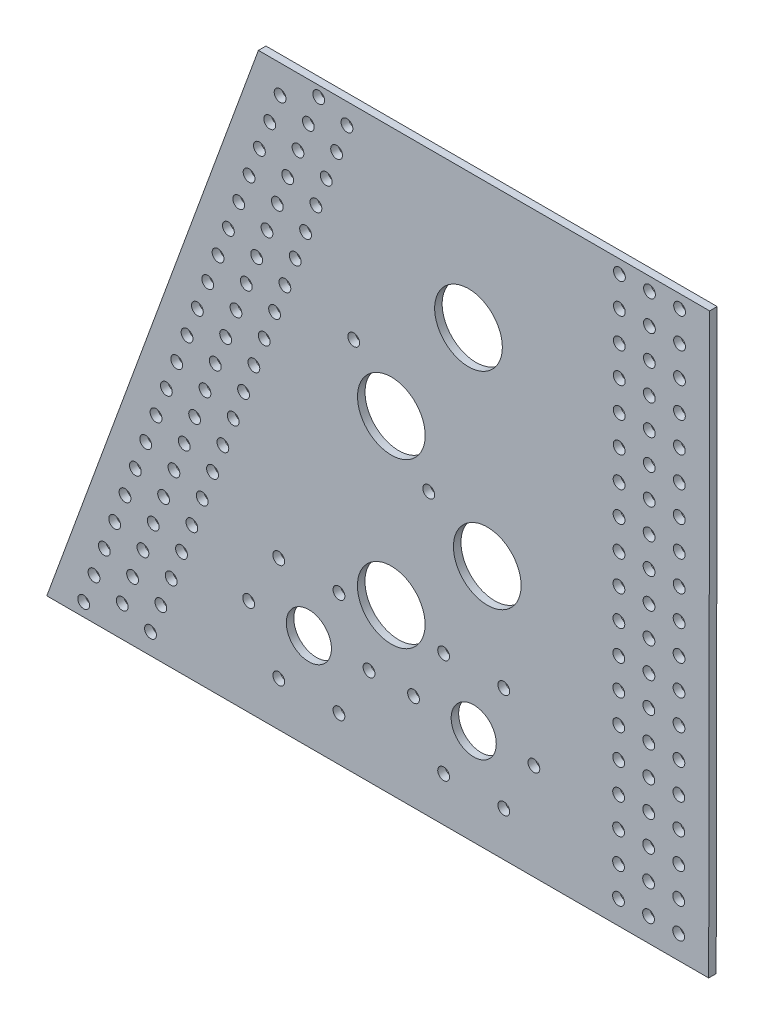
from build123d import *

# Parameters (mm, degrees)
SKETCH4_R           = 14.2875
SKETCH4_R_2         = 2.4892
SKETCH4_R_3         = 9.525
BOSS_EXTRUDE2_DEPTH = 3.175
SKETCH11_R          = 2.4892
CUT_EXTRUDE2_DEPTH  = 3.175


with BuildPart() as part:
    # Sketch4 → Boss-Extrude2 (new body)
    with BuildSketch(Plane.XY):
        Polygon((93.776397203, 244.095891287), (284.276397203, 244.095891287), (283.85323076, 0), (4.45323076, 0), align=None)
        with Locations((182.46816735, 187.031911832)):
            Circle(SKETCH4_R, mode=Mode.SUBTRACT)
        with Locations((149.900784931, 138.468767486)):
            Circle(SKETCH4_R, mode=Mode.SUBTRACT)
        with Locations((134.00552713, 158.435496689)):
            Circle(SKETCH4_R_2, mode=Mode.SUBTRACT)
        with Locations((165.694943773, 118.731329743)):
            Circle(SKETCH4_R_2, mode=Mode.SUBTRACT)
        with Locations((190.39276448, 103.84941923)):
            Circle(SKETCH4_R, mode=Mode.SUBTRACT)
        with Locations((149.858385304, 69.329241783)):
            Circle(SKETCH4_R, mode=Mode.SUBTRACT)
        with Locations((197.368237983, 18.743845986)):
            Circle(SKETCH4_R_2, mode=Mode.SUBTRACT)
        with Locations((115.072237983, 40.740891242)):
            Circle(SKETCH4_R_3, mode=Mode.SUBTRACT)
        with Locations((184.668237983, 40.740891242)):
            Circle(SKETCH4_R_3, mode=Mode.SUBTRACT)
        with Locations((210.068237983, 40.740891242)):
            Circle(SKETCH4_R_2, mode=Mode.SUBTRACT)
        with Locations((171.968237983, 18.743845986)):
            Circle(SKETCH4_R_2, mode=Mode.SUBTRACT)
        with Locations((159.268237983, 40.740891242)):
            Circle(SKETCH4_R_2, mode=Mode.SUBTRACT)
        with Locations((171.968237983, 62.737936498)):
            Circle(SKETCH4_R_2, mode=Mode.SUBTRACT)
        with Locations((197.368237983, 62.737936498)):
            Circle(SKETCH4_R_2, mode=Mode.SUBTRACT)
        with Locations((140.472237983, 40.740891242)):
            Circle(SKETCH4_R_2, mode=Mode.SUBTRACT)
        with Locations((127.772237983, 18.743845986)):
            Circle(SKETCH4_R_2, mode=Mode.SUBTRACT)
        with Locations((102.372237983, 18.743845986)):
            Circle(SKETCH4_R_2, mode=Mode.SUBTRACT)
        with Locations((89.672237983, 40.740891242)):
            Circle(SKETCH4_R_2, mode=Mode.SUBTRACT)
        with Locations((102.372237983, 62.737936498)):
            Circle(SKETCH4_R_2, mode=Mode.SUBTRACT)
        with Locations((127.772237983, 62.737936498)):
            Circle(SKETCH4_R_2, mode=Mode.SUBTRACT)
    extrude(amount=BOSS_EXTRUDE2_DEPTH)

    # Sketch11 → Cut-Extrude2 (cut)
    with BuildSketch(Plane.XY.offset(3.175)):
        with Locations((271.566690721, 238.507891287)):
            Circle(SKETCH11_R)
        with Locations((258.866690721, 238.507891287)):
            Circle(SKETCH11_R)
        with Locations((246.166690721, 238.507891287)):
            Circle(SKETCH11_R)
        with Locations((258.84467394, 225.807910372)):
            Circle(SKETCH11_R)
        with Locations((246.14467394, 225.807910372)):
            Circle(SKETCH11_R)
        with Locations((258.822657159, 213.107929456)):
            Circle(SKETCH11_R)
        with Locations((246.122657159, 213.107929456)):
            Circle(SKETCH11_R)
        with Locations((258.800640378, 200.40794854)):
            Circle(SKETCH11_R)
        with Locations((246.100640378, 200.40794854)):
            Circle(SKETCH11_R)
        with Locations((258.778623597, 187.707967624)):
            Circle(SKETCH11_R)
        with Locations((246.078623597, 187.707967624)):
            Circle(SKETCH11_R)
        with Locations((258.756606817, 175.007986708)):
            Circle(SKETCH11_R)
        with Locations((246.056606817, 175.007986708)):
            Circle(SKETCH11_R)
        with Locations((258.734590036, 162.308005793)):
            Circle(SKETCH11_R)
        with Locations((246.034590036, 162.308005793)):
            Circle(SKETCH11_R)
        with Locations((258.712573255, 149.608024877)):
            Circle(SKETCH11_R)
        with Locations((246.012573255, 149.608024877)):
            Circle(SKETCH11_R)
        with Locations((258.690556474, 136.908043961)):
            Circle(SKETCH11_R)
        with Locations((245.990556474, 136.908043961)):
            Circle(SKETCH11_R)
        with Locations((258.668539693, 124.208063045)):
            Circle(SKETCH11_R)
        with Locations((245.968539693, 124.208063045)):
            Circle(SKETCH11_R)
        with Locations((258.646522912, 111.508082129)):
            Circle(SKETCH11_R)
        with Locations((245.946522912, 111.508082129)):
            Circle(SKETCH11_R)
        with Locations((258.624506131, 98.808101214)):
            Circle(SKETCH11_R)
        with Locations((245.924506131, 98.808101214)):
            Circle(SKETCH11_R)
        with Locations((258.60248935, 86.108120298)):
            Circle(SKETCH11_R)
        with Locations((245.90248935, 86.108120298)):
            Circle(SKETCH11_R)
        with Locations((258.58047257, 73.408139382)):
            Circle(SKETCH11_R)
        with Locations((245.88047257, 73.408139382)):
            Circle(SKETCH11_R)
        with Locations((258.558455789, 60.708158466)):
            Circle(SKETCH11_R)
        with Locations((245.858455789, 60.708158466)):
            Circle(SKETCH11_R)
        with Locations((258.536439008, 48.008177551)):
            Circle(SKETCH11_R)
        with Locations((245.836439008, 48.008177551)):
            Circle(SKETCH11_R)
        with Locations((258.514422227, 35.308196635)):
            Circle(SKETCH11_R)
        with Locations((245.814422227, 35.308196635)):
            Circle(SKETCH11_R)
        with Locations((258.492405446, 22.608215719)):
            Circle(SKETCH11_R)
        with Locations((245.792405446, 22.608215719)):
            Circle(SKETCH11_R)
        with Locations((258.470388665, 9.908234803)):
            Circle(SKETCH11_R)
        with Locations((245.770388665, 9.908234803)):
            Circle(SKETCH11_R)
        with Locations((271.54467394, 225.807910372)):
            Circle(SKETCH11_R)
        with Locations((271.522657159, 213.107929456)):
            Circle(SKETCH11_R)
        with Locations((271.500640378, 200.40794854)):
            Circle(SKETCH11_R)
        with Locations((271.478623597, 187.707967624)):
            Circle(SKETCH11_R)
        with Locations((271.456606817, 175.007986708)):
            Circle(SKETCH11_R)
        with Locations((271.434590036, 162.308005793)):
            Circle(SKETCH11_R)
        with Locations((271.412573255, 149.608024877)):
            Circle(SKETCH11_R)
        with Locations((271.390556474, 136.908043961)):
            Circle(SKETCH11_R)
        with Locations((271.368539693, 124.208063045)):
            Circle(SKETCH11_R)
        with Locations((271.346522912, 111.508082129)):
            Circle(SKETCH11_R)
        with Locations((271.324506131, 98.808101214)):
            Circle(SKETCH11_R)
        with Locations((271.30248935, 86.108120298)):
            Circle(SKETCH11_R)
        with Locations((271.28047257, 73.408139382)):
            Circle(SKETCH11_R)
        with Locations((271.258455789, 60.708158466)):
            Circle(SKETCH11_R)
        with Locations((271.236439008, 48.008177551)):
            Circle(SKETCH11_R)
        with Locations((271.214422227, 35.308196635)):
            Circle(SKETCH11_R)
        with Locations((271.192405446, 22.608215719)):
            Circle(SKETCH11_R)
        with Locations((271.170388665, 9.908234803)):
            Circle(SKETCH11_R)
        with Locations((102.931479448, 232.157891287)):
            Circle(SKETCH11_R)
        with Locations((114.858027617, 227.793552988)):
            Circle(SKETCH11_R)
        with Locations((126.784575785, 223.429214688)):
            Circle(SKETCH11_R)
        with Locations((110.493689317, 215.86700482)):
            Circle(SKETCH11_R)
        with Locations((122.420237485, 211.50266652)):
            Circle(SKETCH11_R)
        with Locations((106.129351017, 203.940456651)):
            Circle(SKETCH11_R)
        with Locations((118.055899186, 199.576118352)):
            Circle(SKETCH11_R)
        with Locations((101.765012718, 192.013908483)):
            Circle(SKETCH11_R)
        with Locations((113.691560886, 187.649570184)):
            Circle(SKETCH11_R)
        with Locations((97.400674418, 180.087360315)):
            Circle(SKETCH11_R)
        with Locations((109.327222586, 175.723022016)):
            Circle(SKETCH11_R)
        with Locations((93.036336119, 168.160812147)):
            Circle(SKETCH11_R)
        with Locations((104.962884287, 163.796473848)):
            Circle(SKETCH11_R)
        with Locations((88.671997819, 156.234263979)):
            Circle(SKETCH11_R)
        with Locations((100.598545987, 151.869925679)):
            Circle(SKETCH11_R)
        with Locations((84.30765952, 144.307715811)):
            Circle(SKETCH11_R)
        with Locations((96.234207688, 139.943377511)):
            Circle(SKETCH11_R)
        with Locations((79.94332122, 132.381167643)):
            Circle(SKETCH11_R)
        with Locations((91.869869388, 128.016829343)):
            Circle(SKETCH11_R)
        with Locations((75.57898292, 120.454619475)):
            Circle(SKETCH11_R)
        with Locations((87.505531089, 116.090281175)):
            Circle(SKETCH11_R)
        with Locations((71.214644621, 108.528071306)):
            Circle(SKETCH11_R)
        with Locations((83.141192789, 104.163733007)):
            Circle(SKETCH11_R)
        with Locations((66.850306321, 96.601523138)):
            Circle(SKETCH11_R)
        with Locations((78.776854489, 92.237184839)):
            Circle(SKETCH11_R)
        with Locations((62.485968022, 84.67497497)):
            Circle(SKETCH11_R)
        with Locations((74.41251619, 80.310636671)):
            Circle(SKETCH11_R)
        with Locations((58.121629722, 72.748426802)):
            Circle(SKETCH11_R)
        with Locations((70.04817789, 68.384088502)):
            Circle(SKETCH11_R)
        with Locations((53.757291423, 60.821878634)):
            Circle(SKETCH11_R)
        with Locations((65.683839591, 56.457540334)):
            Circle(SKETCH11_R)
        with Locations((49.392953123, 48.895330466)):
            Circle(SKETCH11_R)
        with Locations((61.319501291, 44.530992166)):
            Circle(SKETCH11_R)
        with Locations((45.028614823, 36.968782298)):
            Circle(SKETCH11_R)
        with Locations((56.955162992, 32.604443998)):
            Circle(SKETCH11_R)
        with Locations((40.664276524, 25.042234129)):
            Circle(SKETCH11_R)
        with Locations((52.590824692, 20.67789583)):
            Circle(SKETCH11_R)
        with Locations((36.299938224, 13.115685961)):
            Circle(SKETCH11_R)
        with Locations((48.226486392, 8.751347662)):
            Circle(SKETCH11_R)
        with Locations((98.567141149, 220.231343119)):
            Circle(SKETCH11_R)
        with Locations((94.202802849, 208.304794951)):
            Circle(SKETCH11_R)
        with Locations((89.83846455, 196.378246783)):
            Circle(SKETCH11_R)
        with Locations((85.47412625, 184.451698615)):
            Circle(SKETCH11_R)
        with Locations((81.109787951, 172.525150447)):
            Circle(SKETCH11_R)
        with Locations((76.745449651, 160.598602279)):
            Circle(SKETCH11_R)
        with Locations((72.381111351, 148.67205411)):
            Circle(SKETCH11_R)
        with Locations((68.016773052, 136.745505942)):
            Circle(SKETCH11_R)
        with Locations((63.652434752, 124.818957774)):
            Circle(SKETCH11_R)
        with Locations((59.288096453, 112.892409606)):
            Circle(SKETCH11_R)
        with Locations((54.923758153, 100.965861438)):
            Circle(SKETCH11_R)
        with Locations((50.559419854, 89.03931327)):
            Circle(SKETCH11_R)
        with Locations((46.195081554, 77.112765102)):
            Circle(SKETCH11_R)
        with Locations((41.830743254, 65.186216933)):
            Circle(SKETCH11_R)
        with Locations((37.466404955, 53.259668765)):
            Circle(SKETCH11_R)
        with Locations((33.102066655, 41.333120597)):
            Circle(SKETCH11_R)
        with Locations((28.737728356, 29.406572429)):
            Circle(SKETCH11_R)
        with Locations((24.373390056, 17.480024261)):
            Circle(SKETCH11_R)
        with Locations((20.009051757, 5.553476093)):
            Circle(SKETCH11_R)
        with Locations((119.222365916, 239.720101156)):
            Circle(SKETCH11_R)
        with Locations((131.148914084, 235.355762856)):
            Circle(SKETCH11_R)
    extrude(amount=-CUT_EXTRUDE2_DEPTH, mode=Mode.SUBTRACT)


solid = part.part
